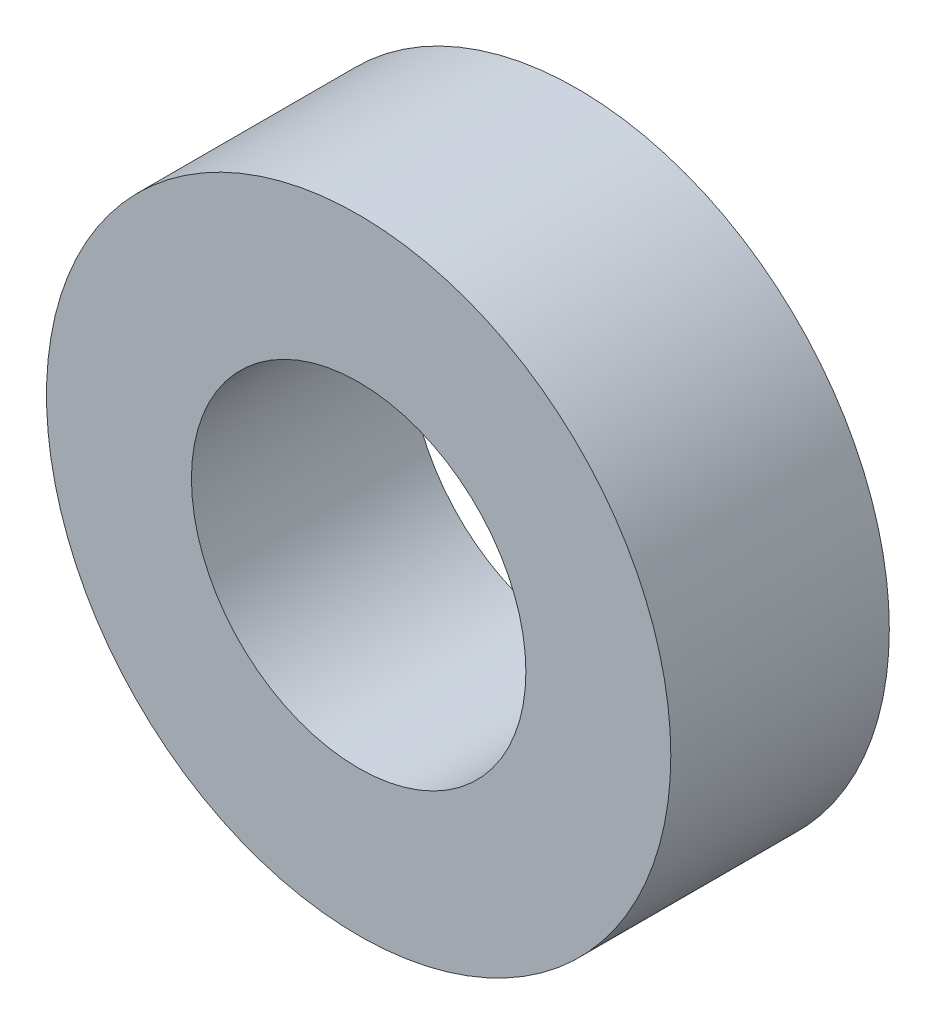
from build123d import *

# Parameters (mm, degrees)
SKETCH1_R           = 8.89
SKETCH1_R_2         = 4.7625
BOSS_EXTRUDE1_DEPTH = 3.1115


with BuildPart() as part:
    # Sketch1 → Boss-Extrude1 (new, symmetric)
    with BuildSketch(Plane.XY):
        Circle(SKETCH1_R)
        Circle(SKETCH1_R_2, mode=Mode.SUBTRACT)
    extrude(amount=BOSS_EXTRUDE1_DEPTH, both=True)


solid = part.part
